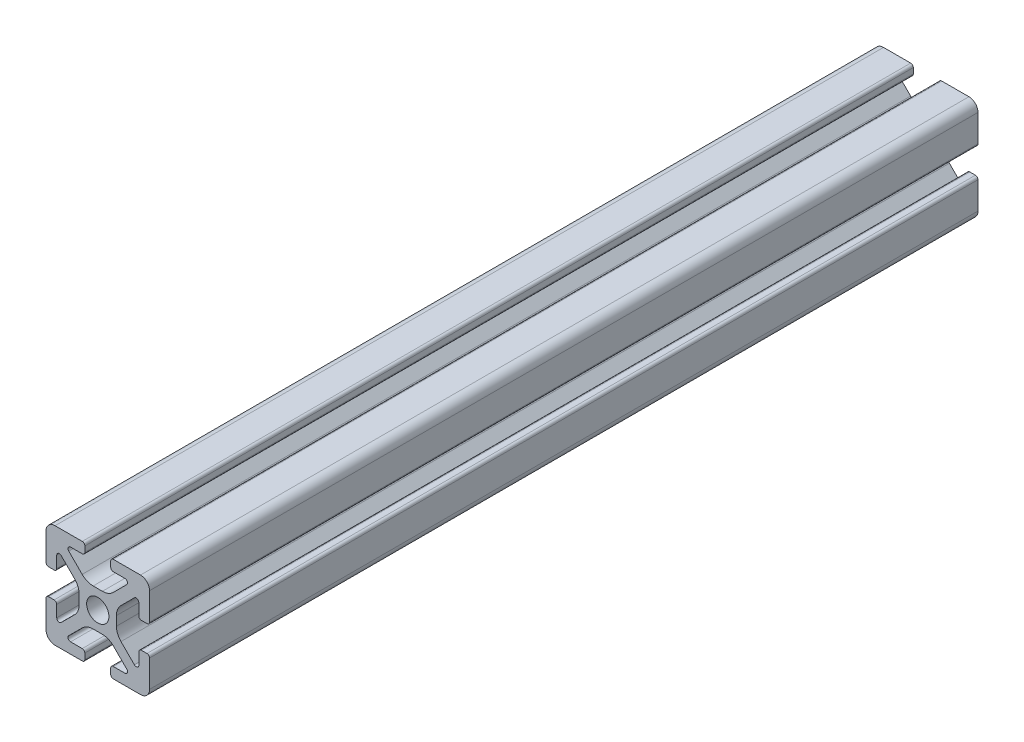
from build123d import *

# Parameters (mm, degrees)
BOSS_EXTRUDE1_DEPTH = 80


with BuildPart() as part:
    # Sketch4 → Boss-Extrude1 (new, symmetric)
    with BuildSketch(Plane.XY):
        with BuildLine():
            Line((3, -10), (8.25, -10))
            ThreePointArc((8.25, -10), (9.487436867, -9.487436867), (10, -8.25))
            Line((10, -8.25), (10, -3))
            ThreePointArc((10, -3), (9.853553391, -2.646446609), (9.5, -2.5))
            Line((9.5, -2.5), (8.424621202, -2.5))
            ThreePointArc((8.424621202, -2.5), (8.071067812, -2.646446609), (7.924621202, -3))
            Line((7.924621202, -3), (7.924621202, -5.25))
            ThreePointArc((7.924621202, -5.25), (7.615962919, -5.711939766), (7.071067812, -5.603553391))
            Line((7.071067812, -5.603553391), (4.478679656, -3.011165235))
            ThreePointArc((4.478679656, -3.011165235), (3.828361402, -2.037895189), (3.6, -0.889844892))
            Line((3.6, -0.889844892), (3.6, 0))
            Line((3.6, 0), (2.15, 0))
            ThreePointArc((2.15, 0), (1.52027958, -1.52027958), (0, -2.15))
            Line((0, -2.15), (0, -3.6))
            Line((0, -3.6), (0.889844892, -3.6))
            ThreePointArc((0.889844892, -3.6), (2.037895189, -3.828361402), (3.011165235, -4.478679656))
            Line((3.011165235, -4.478679656), (5.603553391, -7.071067812))
            ThreePointArc((5.603553391, -7.071067812), (5.711939766, -7.615962919), (5.25, -7.924621202))
            Line((5.25, -7.924621202), (3, -7.924621202))
            ThreePointArc((3, -7.924621202), (2.646446609, -8.071067812), (2.5, -8.424621202))
            Line((2.5, -8.424621202), (2.5, -9.5))
            ThreePointArc((2.5, -9.5), (2.646446609, -9.853553391), (3, -10))
        make_face()
    extrude(amount=BOSS_EXTRUDE1_DEPTH, both=True)

    # Mirror1: part across plane


with BuildPart() as part_1:
    add(part.part)
    add(part.part.mirror(Plane(origin=(0, 0, 0), x_dir=(0, 0, 1), z_dir=(1, 0, 0))))

    # Mirror2: part across plane


with BuildPart() as part_2:
    add(part_1.part)
    add(part_1.part.mirror(Plane.ZX))


solid = part_2.part
